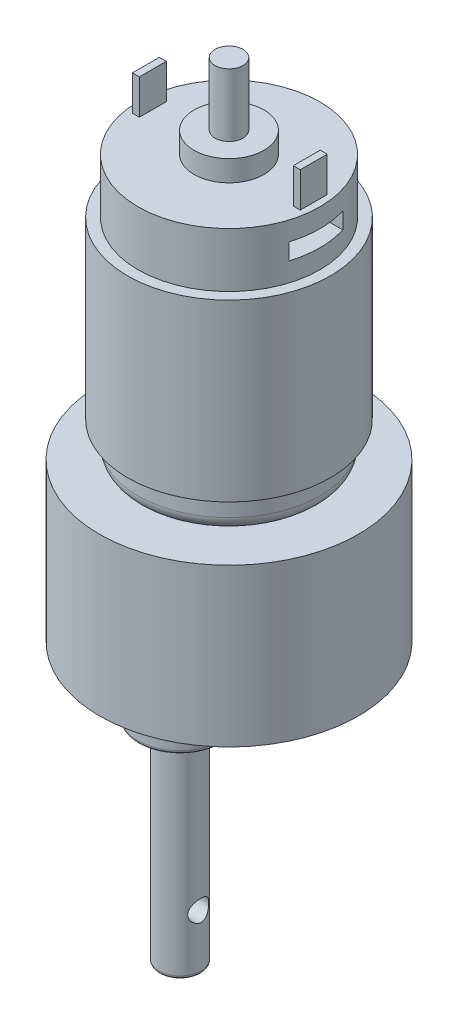
from build123d import *

# Parameters (mm, degrees)
SKETCH1_R                  = 18.5
BOSS_EXTRUDE1_DEPTH        = 22.5
SKETCH2_R                  = 13
BOSS_EXTRUDE2_DEPTH        = 37.8
SKETCH3_R                  = 14.5
BOSS_EXTRUDE3_DEPTH        = 25
FILLET1_R                  = 2
SKETCH4_R                  = 6
BOSS_EXTRUDE4_DEPTH        = 6.3
FILLET2_R                  = 0.5
SKETCH5_R                  = 3
BOSS_EXTRUDE5_DEPTH        = 30
FILLET3_R                  = 0.5
CUT_EXTRUDE1_DEPTH         = 30
CUT_EXTRUDE1_DEPTH_BACK    = 30
SKETCH6_R                  = 1.5
CUT_EXTRUDE2_DEPTH         = 30
CUT_EXTRUDE2_DEPTH_BACK    = 30
SKETCH7_W                  = 7.711651184
SKETCH7_H                  = 2.356337862
SKETCH8_R                  = 5
BOSS_EXTRUDE6_DEPTH        = 3
SKETCH9_R                  = 2
BOSS_EXTRUDE7_DEPTH        = 9
SKETCH10_W                 = 1
SKETCH10_H                 = 3.854338548
BOSS_EXTRUDE8_DEPTH        = 5
BOSS_EXTRUDE8_2_DEPTH      = 5
M3_TAPPED_HOLE1_AT_2_COUNT = 2
M3_TAPPED_HOLE1_AT_2_PITCH = 15.5
M3_TAPPED_HOLE1_AT_3_COUNT = 2
M3_TAPPED_HOLE1_AT_3_PITCH = 26.846787517
M3_TAPPED_HOLE1_AT_4_COUNT = 2
M3_TAPPED_HOLE1_AT_4_PITCH = 31
M3_TAPPED_HOLE1_AT_5_COUNT = 2
M3_TAPPED_HOLE1_AT_5_PITCH = 26.846787517
M3_TAPPED_HOLE1_AT_6_COUNT = 2
M3_TAPPED_HOLE1_AT_6_PITCH = 15.5


with BuildPart() as part:
    # Sketch1 → Boss-Extrude1 (new body)
    with BuildSketch(Plane(origin=(0, 0, 0), x_dir=(1, 0, 0), z_dir=(0, 1, 0))):
        Circle(SKETCH1_R)
    extrude(amount=BOSS_EXTRUDE1_DEPTH)

    # Sketch4 → Boss-Extrude4 (add)
    with BuildSketch(Plane.XZ):
        with Locations((0, 7)):
            Circle(SKETCH4_R)
    extrude(amount=BOSS_EXTRUDE4_DEPTH)

    # Fillet2
    fillet2_edges = [part.edges().sort_by_distance(p)[0] for p in [
        (-6, -6.3, 7),
    ]]
    fillet(fillet2_edges, radius=FILLET2_R)

    # Sketch12 → M3 Tapped Hole1 (revolve, cut)
    with BuildSketch(Plane(origin=(-15.5, 0, 0), x_dir=(0, 0, -1), z_dir=(1, 0, 0))):
        Polygon((0, 0), (0, 4.251075774), (1.25, 3.5), (1.25, 0), align=None)
    m3_tapped_hole1 = revolve(axis=Axis((-15.5, -6.35, 0), (0, 1, 0)), mode=Mode.SUBTRACT)

    # M3 Tapped Hole1 at 2: M3 Tapped Hole1 ×2
    with Locations(*[Vector(0.5000000000000011, 0, 0.866025403784438) * (i * M3_TAPPED_HOLE1_AT_2_PITCH) for i in range(1, M3_TAPPED_HOLE1_AT_2_COUNT)]):
        add(m3_tapped_hole1, mode=Mode.SUBTRACT)

    # M3 Tapped Hole1 at 3: M3 Tapped Hole1 ×2
    with Locations(*[Vector(0.8660254037844397, 0, 0.4999999999999981) * (i * M3_TAPPED_HOLE1_AT_3_PITCH) for i in range(1, M3_TAPPED_HOLE1_AT_3_COUNT)]):
        add(m3_tapped_hole1, mode=Mode.SUBTRACT)

    # M3 Tapped Hole1 at 4: M3 Tapped Hole1 ×2
    with Locations(*[(i * M3_TAPPED_HOLE1_AT_4_PITCH, 0, 0) for i in range(1, M3_TAPPED_HOLE1_AT_4_COUNT)]):
        add(m3_tapped_hole1, mode=Mode.SUBTRACT)

    # M3 Tapped Hole1 at 5: M3 Tapped Hole1 ×2
    with Locations(*[Vector(0.8660254037844383, 0, -0.5000000000000007) * (i * M3_TAPPED_HOLE1_AT_5_PITCH) for i in range(1, M3_TAPPED_HOLE1_AT_5_COUNT)]):
        add(m3_tapped_hole1, mode=Mode.SUBTRACT)

    # M3 Tapped Hole1 at 6: M3 Tapped Hole1 ×2
    with Locations(*[Vector(0.49999999999999795, 0, -0.8660254037844399) * (i * M3_TAPPED_HOLE1_AT_6_PITCH) for i in range(1, M3_TAPPED_HOLE1_AT_6_COUNT)]):
        add(m3_tapped_hole1, mode=Mode.SUBTRACT)


with BuildPart() as body_2:
    # Sketch2 → Boss-Extrude2 (new body)
    with BuildSketch(Plane(origin=(0, 22.5, 0), x_dir=(1, 0, 0), z_dir=(0, 1, 0))):
        Circle(SKETCH2_R)
    extrude(amount=BOSS_EXTRUDE2_DEPTH)

    # Sketch3 → Boss-Extrude3 (add)
    with BuildSketch(Plane(origin=(0, 27.5, 0), x_dir=(1, 0, 0), z_dir=(0, 1, 0))):
        Circle(SKETCH3_R)
    extrude(amount=BOSS_EXTRUDE3_DEPTH)

    # Fillet1
    fillet1_edges = [body_2.edges().sort_by_distance(p)[0] for p in [
        (-13, 22.5, 0),
    ]]
    fillet(fillet1_edges, radius=FILLET1_R)

    # Sketch7 → Cut-Extrude2 (cut, two sides: drawn at the far end of the back side and taken through both)
    with BuildSketch(Plane(origin=(0, 0, 0), x_dir=(0, 0, -1), z_dir=(1, 0, 0)).offset(-CUT_EXTRUDE2_DEPTH_BACK)):
        with Locations((0, 56.4)):
            Rectangle(SKETCH7_W, SKETCH7_H)
    extrude(amount=CUT_EXTRUDE2_DEPTH + CUT_EXTRUDE2_DEPTH_BACK, mode=Mode.SUBTRACT)

    # Sketch8 → Boss-Extrude6 (add)
    with BuildSketch(Plane(origin=(0, 60.3, 0), x_dir=(1, 0, 0), z_dir=(0, 1, 0))):
        Circle(SKETCH8_R)
    extrude(amount=BOSS_EXTRUDE6_DEPTH)

    # Sketch9 → Boss-Extrude7 (add)
    with BuildSketch(Plane(origin=(0, 63.3, 0), x_dir=(1, 0, 0), z_dir=(0, 1, 0))):
        Circle(SKETCH9_R)
    extrude(amount=BOSS_EXTRUDE7_DEPTH)


with BuildPart() as body_3:
    # Sketch5 → Boss-Extrude5 (new body)
    with BuildSketch(Plane.XZ.offset(6.3)):
        with Locations((0, 7)):
            Circle(SKETCH5_R)
    extrude(amount=BOSS_EXTRUDE5_DEPTH)

    # Fillet3
    fillet3_edges = [body_3.edges().sort_by_distance(p)[0] for p in [
        (-3, -36.3, 7),
    ]]
    fillet(fillet3_edges, radius=FILLET3_R)

    # Sketch6 → Cut-Extrude1 (cut, two sides: drawn at the far end of the back side and taken through both)
    with BuildSketch(Plane(origin=(0, 0, 0), x_dir=(0, 0, -1), z_dir=(1, 0, 0)).offset(-CUT_EXTRUDE1_DEPTH_BACK)):
        with Locations((-7, -28.3)):
            Circle(SKETCH6_R)
    extrude(amount=CUT_EXTRUDE1_DEPTH + CUT_EXTRUDE1_DEPTH_BACK, mode=Mode.SUBTRACT)


with BuildPart() as body_4:
    # Sketch10 → Boss-Extrude8 (new body)
    with BuildSketch(Plane(origin=(0, 60.3, 0), x_dir=(1, 0, 0), z_dir=(0, 1, 0))):
        with Locations((11.5, 0.116798138)):
            Rectangle(SKETCH10_W, SKETCH10_H)
    extrude(amount=BOSS_EXTRUDE8_DEPTH)


with BuildPart() as body_5:
    # Sketch10 → Boss-Extrude8 2 (new body)
    with BuildSketch(Plane(origin=(0, 60.3, 0), x_dir=(1, 0, 0), z_dir=(0, 1, 0))):
        with Locations((-11.5, 0.116798138)):
            Rectangle(SKETCH10_W, SKETCH10_H)
    extrude(amount=BOSS_EXTRUDE8_2_DEPTH)


solid = Compound([part.part, body_2.part, body_3.part, body_4.part, body_5.part])
